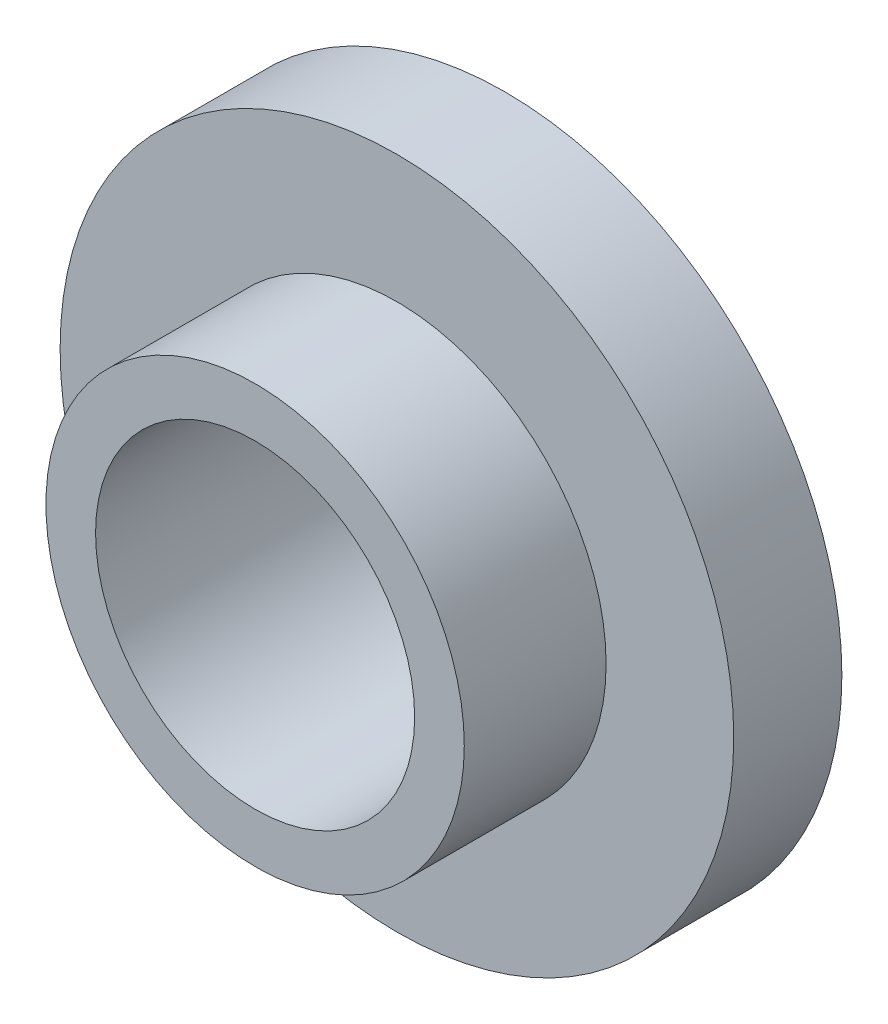
from build123d import *
from build123d.topology import SkipClean

# Parameters (mm, degrees)
SCHIZZO1_R                   = 5.9
SCHIZZO1_R_2                 = 4.5
ESTRUSIONE_ESTRUSIONE1_DEPTH = 4
ESTRUSIONE_ESTRUSIONE2_START = 4
SCHIZZO2_R                   = 9.5
SCHIZZO2_R_2                 = 4.5
ESTRUSIONE_ESTRUSIONE2_DEPTH = 4
SCHIZZO3_R                   = 9.5
TAGLIO_ESTRUSIONE1_DEPTH     = 0.95


with BuildPart() as part:
    # Schizzo1 → Estrusione-Estrusione1 (new body)
    with BuildSketch(Plane.XY):
        Circle(SCHIZZO1_R)
        Circle(SCHIZZO1_R_2, mode=Mode.SUBTRACT)
    extrude(amount=ESTRUSIONE_ESTRUSIONE1_DEPTH)

    # Schizzo2 → Estrusione-Estrusione2 (add)
    with SkipClean():  # the faces are left unmerged after this step: merging them gives an invalid solid
        with BuildSketch(Plane(origin=(0, 0, 0), x_dir=(-1, 0, 0), z_dir=(0, 0, -1)).offset(ESTRUSIONE_ESTRUSIONE2_START)):
            Circle(SCHIZZO2_R)
            Circle(SCHIZZO2_R_2, mode=Mode.SUBTRACT)
        extrude(amount=-ESTRUSIONE_ESTRUSIONE2_DEPTH)

    # Schizzo3 → Taglio-Estrusione1 (cut)
    with SkipClean():  # the faces are left unmerged after this step: merging them gives an invalid solid
        with BuildSketch(Plane(origin=(0, 0, -4), x_dir=(-1, 0, 0), z_dir=(0, 0, -1))):
            Circle(SCHIZZO3_R)
        extrude(amount=-TAGLIO_ESTRUSIONE1_DEPTH, mode=Mode.SUBTRACT)


solid = part.part
